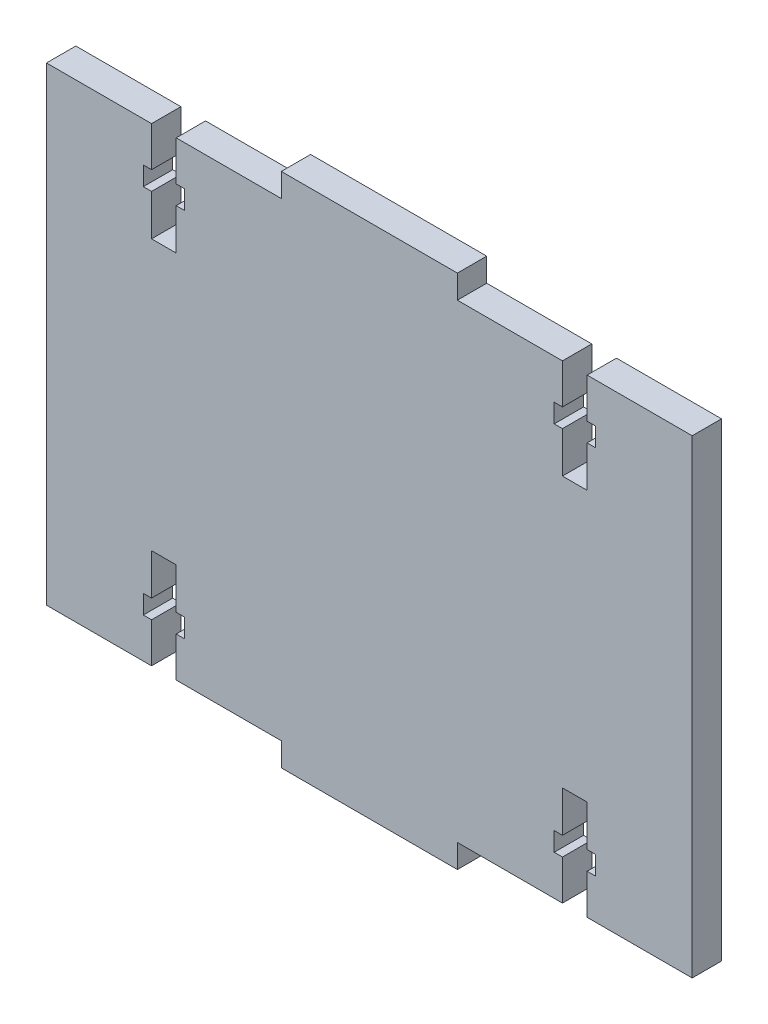
from build123d import *

# Parameters (mm, degrees)
ESQUISSE1_W             = 110
ESQUISSE1_H             = 80
BOSS_EXTRU_1_DEPTH      = 5
ENL_V_MAT_EXTRU_2_DEPTH = 137.106575888
ESQUISSE4_W             = 30
ESQUISSE4_H             = 88
BOSS_EXTRU_2_DEPTH      = 5


with BuildPart() as part:
    # Esquisse1 → Boss.-Extru.1 (new body)
    with BuildSketch(Plane.XY):
        with Locations((55, 40)):
            Rectangle(ESQUISSE1_W, ESQUISSE1_H)
    extrude(amount=BOSS_EXTRU_1_DEPTH)

    # Esquisse3 → Enlèv. mat.-Extru.2 (cut, through all)
    with BuildSketch(Plane.XY.offset(5)):
        Polygon((22.1, 80), (17.9, 80), (17.9, 73.2), (16.5, 73.2), (16.5, 70), (17.9, 70), (17.9, 63), (22.1, 63), (22.1, 70), (23.5, 70), (23.5, 73.2), (22.1, 73.2), align=None)
        Polygon((87.9, 80), (87.9, 73.2), (86.5, 73.2), (86.5, 70), (87.9, 70), (87.9, 63), (92.1, 63), (92.1, 70), (93.5, 70), (93.5, 73.2), (92.1, 73.2), (92.1, 80), align=None)
        Polygon((87.9, 0), (92.1, 0), (92.1, 6.8), (93.5, 6.8), (93.5, 10), (92.1, 10), (92.1, 17), (87.9, 17), (87.9, 10), (86.5, 10), (86.5, 6.8), (87.9, 6.8), align=None)
        Polygon((22.1, 0), (22.1, 6.8), (23.5, 6.8), (23.5, 10), (22.1, 10), (22.1, 17), (17.9, 17), (17.9, 10), (16.5, 10), (16.5, 6.8), (17.9, 6.8), (17.9, 0), align=None)
    extrude(amount=-ENL_V_MAT_EXTRU_2_DEPTH, mode=Mode.SUBTRACT)

    # Esquisse4 → Boss.-Extru.2 (add)
    with BuildSketch(Plane(origin=(0, 0, 0), x_dir=(-1, 0, 0), z_dir=(0, 0, -1))):
        with Locations((-55, 40)):
            Rectangle(ESQUISSE4_W, ESQUISSE4_H)
    extrude(amount=-BOSS_EXTRU_2_DEPTH)


solid = part.part
